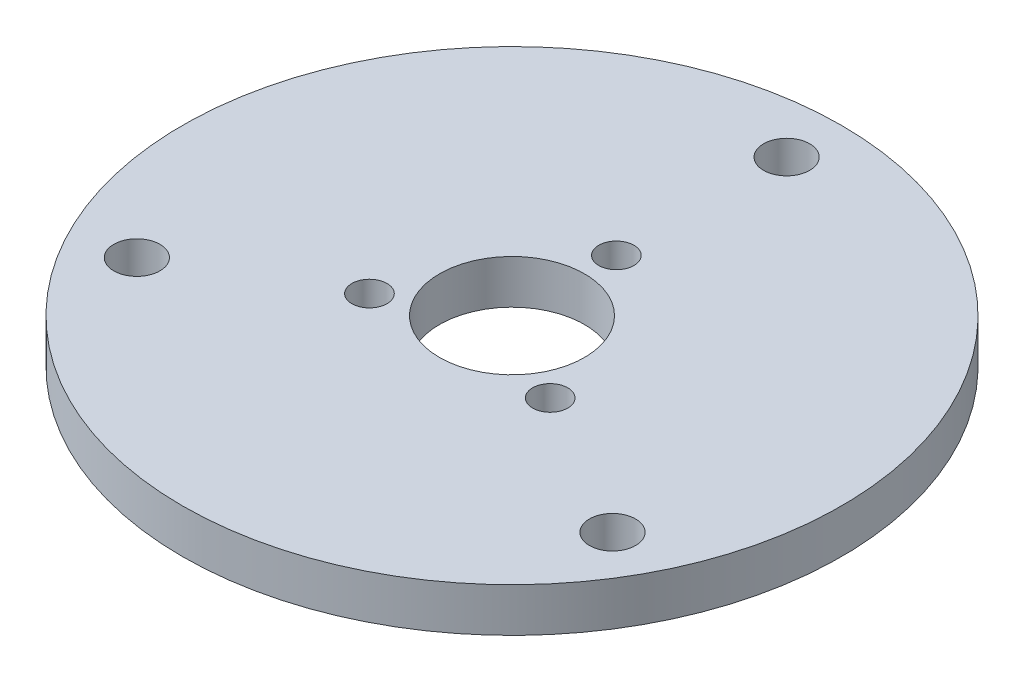
from build123d import *

# Parameters (mm, degrees)
SKETCH_1_R               = 30
EXTRUDE_1_DEPTH          = 4
SKETCH_2_R               = 2.1
CUT_EXTRUDE_1_DEPTH      = 4
PATTERN_CIRCULAR_1_COUNT = 3
SKETCH_3_R               = 6.6
CUT_EXTRUDE_2_DEPTH      = 17
SKETCH_4_R               = 1.6
CUT_EXTRUDE_3_DEPTH      = 17
PATTERN_CIRCULAR_2_COUNT = 3


with BuildPart() as part:
    # 草图1 → 凸台-拉伸1 (new body)
    with BuildSketch(Plane(origin=(0, 0, 0), x_dir=(1, 0, 0), z_dir=(0, 1, 0))):
        with Locations(Location((0, 0, 0), (0, 0, 270))):
            Circle(SKETCH_1_R)
    extrude(amount=EXTRUDE_1_DEPTH)

    # 草图2 → 切除-拉伸1 (cut)
    with BuildSketch(Plane(origin=(0, 4, 0), x_dir=(1, 0, 0), z_dir=(0, 1, 0))):
        with Locations(Location((0, 25, 0), (0, 0, 270))):
            Circle(SKETCH_2_R)
    cut_extrude_1 = extrude(amount=-CUT_EXTRUDE_1_DEPTH, mode=Mode.SUBTRACT)

    # 阵列(圆周)1: 切除-拉伸1 ×3 about axis
    pattern_circular_1_axis = Axis((0, 0, 0), (0, 1, 0))
    for i in range(1, PATTERN_CIRCULAR_1_COUNT):
        add(cut_extrude_1.rotate(pattern_circular_1_axis, i * 360 / PATTERN_CIRCULAR_1_COUNT), mode=Mode.SUBTRACT)

    # 草图3 → 切除-拉伸2 (cut)
    with BuildSketch(Plane(origin=(0, 4, 0), x_dir=(1, 0, 0), z_dir=(0, 1, 0))):
        with Locations(Location((0, 0, 0), (0, 0, 270))):
            Circle(SKETCH_3_R)
    extrude(amount=-CUT_EXTRUDE_2_DEPTH, mode=Mode.SUBTRACT)

    # 草图4 → 切除-拉伸3 (cut)
    with BuildSketch(Plane(origin=(0, 4, 0), x_dir=(1, 0, 0), z_dir=(0, 1, 0))):
        with Locations(Location((8.227241336, -4.75, 0), (0, 0, 270))):
            Circle(SKETCH_4_R)
    cut_extrude_3 = extrude(amount=-CUT_EXTRUDE_3_DEPTH, mode=Mode.SUBTRACT)

    # 阵列(圆周)2: 切除-拉伸3 ×3 about axis
    pattern_circular_2_axis = Axis((0, 0, 0), (0, 1, 0))
    for i in range(1, PATTERN_CIRCULAR_2_COUNT):
        add(cut_extrude_3.rotate(pattern_circular_2_axis, i * 360 / PATTERN_CIRCULAR_2_COUNT), mode=Mode.SUBTRACT)


solid = part.part
